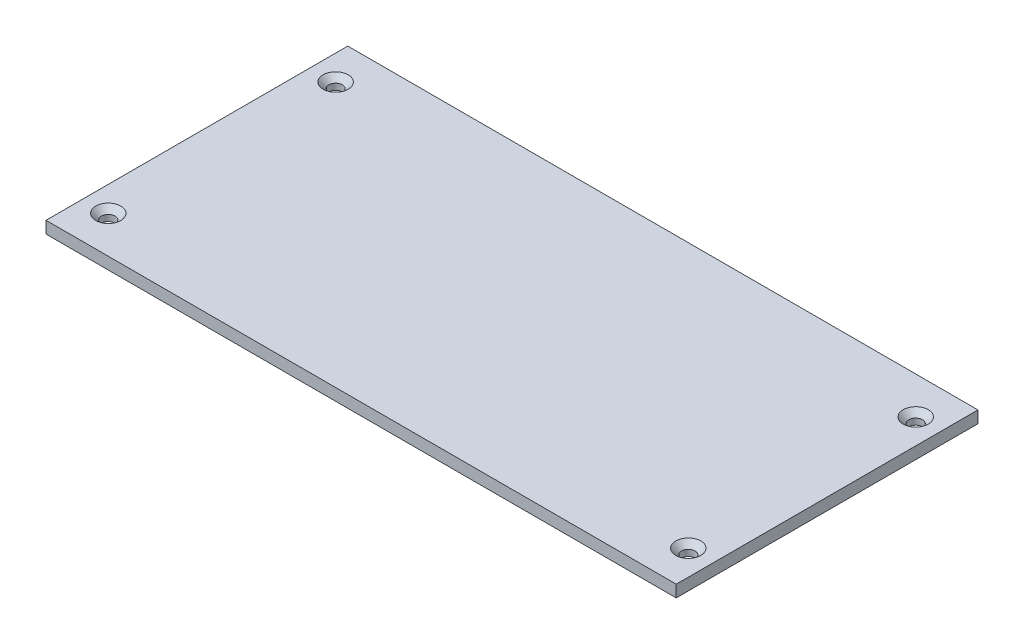
from build123d import *

# Parameters (mm, degrees)
SKETCH1_W                                    = 158.400000192
SKETCH1_H                                    = 75.850000192
BOSS_EXTRUDE1_DEPTH                          = 3
CSK_FOR_M3_COUNTERSUNK_FLAT_HEAD_SCR_2_COUNT = 2
CSK_FOR_M3_COUNTERSUNK_FLAT_HEAD_SCR_2_PITCH = 57.15
CSK_FOR_M3_COUNTERSUNK_FLAT_HEAD_SCR_3_COUNT = 2
CSK_FOR_M3_COUNTERSUNK_FLAT_HEAD_SCR_3_PITCH = 156.596922435
CSK_FOR_M3_COUNTERSUNK_FLAT_HEAD_SCR_4_COUNT = 2
CSK_FOR_M3_COUNTERSUNK_FLAT_HEAD_SCR_4_PITCH = 145.796


with BuildPart() as part:
    # Sketch1 → Boss-Extrude1 (new body)
    with BuildSketch(Plane(origin=(0, 0, 0), x_dir=(1, 0, 0), z_dir=(0, 1, 0))):
        Rectangle(SKETCH1_W, SKETCH1_H)
    extrude(amount=BOSS_EXTRUDE1_DEPTH)

    # Sketch3 → CSK for M3 Countersunk Flat Head Screw1 (revolve, cut)
    with BuildSketch(Plane(origin=(-72.898, 3, -28.575), x_dir=(0, 0, 1), z_dir=(1, 0, 0))):
        Polygon((0, 0), (0, 3), (1.7, 3), (1.7, 1.45), (3.15, 0), align=None)
    csk_for_m3_countersunk_flat_head_screw1 = revolve(axis=Axis((-72.898, 9.35, -28.575), (0, -1, 0)), mode=Mode.SUBTRACT)

    # CSK for M3 Countersunk Flat Head Scr 2: CSK for M3 Countersunk Flat Head Screw1 ×2
    with Locations(*[(0, 0, i * CSK_FOR_M3_COUNTERSUNK_FLAT_HEAD_SCR_2_PITCH) for i in range(1, CSK_FOR_M3_COUNTERSUNK_FLAT_HEAD_SCR_2_COUNT)]):
        add(csk_for_m3_countersunk_flat_head_screw1, mode=Mode.SUBTRACT)

    # CSK for M3 Countersunk Flat Head Scr 3: CSK for M3 Countersunk Flat Head Screw1 ×2
    with Locations(*[Vector(0.9310272368912862, 0, 0.3649497008720199) * (i * CSK_FOR_M3_COUNTERSUNK_FLAT_HEAD_SCR_3_PITCH) for i in range(1, CSK_FOR_M3_COUNTERSUNK_FLAT_HEAD_SCR_3_COUNT)]):
        add(csk_for_m3_countersunk_flat_head_screw1, mode=Mode.SUBTRACT)

    # CSK for M3 Countersunk Flat Head Scr 4: CSK for M3 Countersunk Flat Head Screw1 ×2
    with Locations(*[(i * CSK_FOR_M3_COUNTERSUNK_FLAT_HEAD_SCR_4_PITCH, 0, 0) for i in range(1, CSK_FOR_M3_COUNTERSUNK_FLAT_HEAD_SCR_4_COUNT)]):
        add(csk_for_m3_countersunk_flat_head_screw1, mode=Mode.SUBTRACT)


solid = part.part
